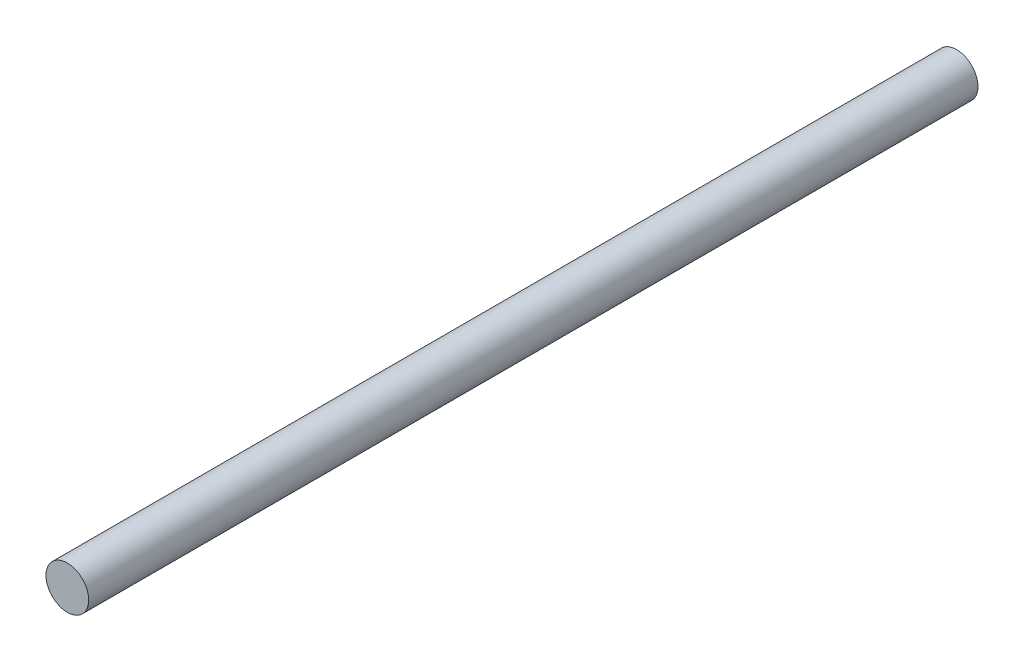
from build123d import *

# Parameters (mm, degrees)
SKETCH1_R           = 3.96875
BOSS_EXTRUDE1_DEPTH = 165.1


with BuildPart() as part:
    # Sketch1 → Boss-Extrude1 (new body)
    with BuildSketch(Plane.XY):
        Circle(SKETCH1_R)
    extrude(amount=BOSS_EXTRUDE1_DEPTH)


solid = part.part
